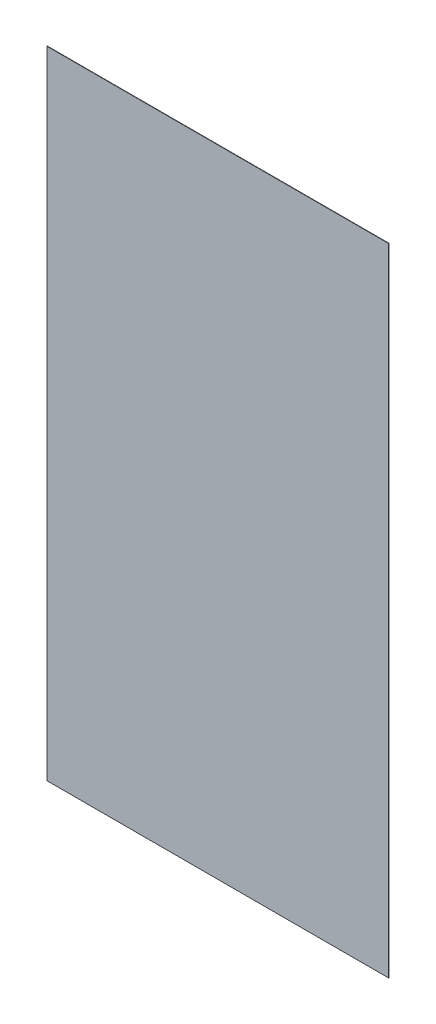
from build123d import *

# Parameters (mm, degrees)
SKETCH1_W           = 873
SKETCH1_H           = 1625
BOSS_EXTRUDE1_DEPTH = 1


with BuildPart() as part:
    # Sketch1 → Boss-Extrude1 (new body)
    with BuildSketch(Plane.XY):
        with Locations((436.5, 812.5)):
            Rectangle(SKETCH1_W, SKETCH1_H)
    extrude(amount=BOSS_EXTRUDE1_DEPTH)


solid = part.part
